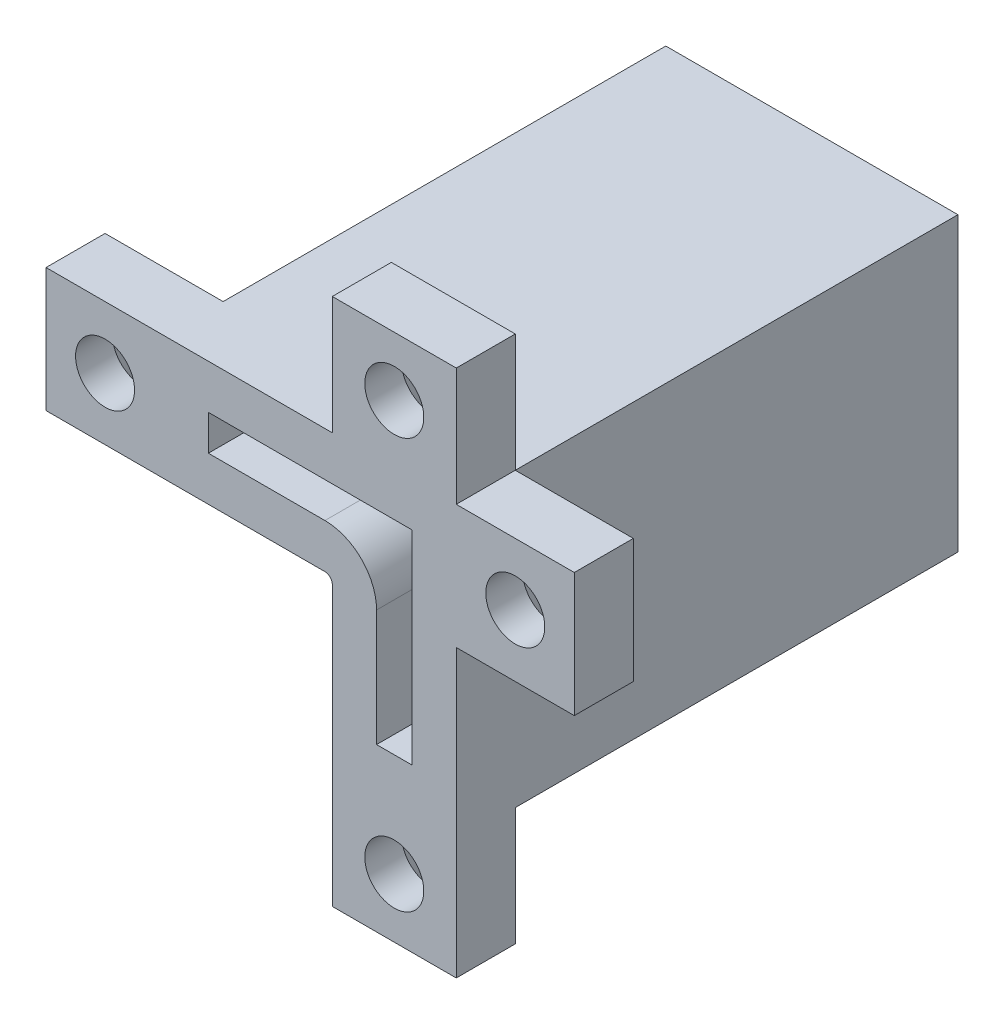
from build123d import *

# Parameters (mm, degrees)
BOSS_EXTRUDE1_DEPTH = 30
BOSS_EXTRUDE2_DEPTH = 4
SKETCH4_R           = 2
CUT_EXTRUDE1_DEPTH  = 4
CHAMFER1_SIZE       = 1.5


with BuildPart() as part:
    # Sketch2 → Boss-Extrude1 (new body)
    with BuildSketch(Plane.XY.offset(10)):
        with BuildLine():
            Line((-14.944066591, 82.328103542), (-14.944066591, 62.528103542))
            Line((-14.944066591, 62.528103542), (-23.344066591, 62.528103542))
            Line((-23.344066591, 62.528103542), (-23.344066591, 73.428103542))
            ThreePointArc((-23.344066591, 73.428103542), (-23.490513201, 73.781656932), (-23.844066591, 73.928103542))
            Line((-23.844066591, 73.928103542), (-34.744066591, 73.928103542))
            Line((-34.744066591, 73.928103542), (-34.744066591, 82.328103542))
            Line((-34.744066591, 82.328103542), (-14.944066591, 82.328103542))
        make_face()
        with BuildLine():
            Line((-17.944066591, 79.328103542), (-17.944066591, 65.528103542))
            Line((-17.944066591, 65.528103542), (-20.344066591, 65.528103542))
            Line((-20.344066591, 65.528103542), (-20.344066591, 73.428103542))
            ThreePointArc((-20.344066591, 73.428103542), (-21.369192857, 75.902977276), (-23.844066591, 76.928103542))
            Line((-23.844066591, 76.928103542), (-31.744066591, 76.928103542))
            Line((-31.744066591, 76.928103542), (-31.744066591, 79.328103542))
            Line((-31.744066591, 79.328103542), (-17.944066591, 79.328103542))
        make_face(mode=Mode.SUBTRACT)
    extrude(amount=BOSS_EXTRUDE1_DEPTH)

    # Sketch3 → Boss-Extrude2 (add)
    with BuildSketch(Plane.XY.offset(40)):
        with BuildLine():
            Line((-34.744066591, 82.328103542), (-42.744066591, 82.328103542))
            Line((-42.744066591, 82.328103542), (-42.744066591, 73.928103542))
            Line((-42.744066591, 73.928103542), (-34.744066591, 73.928103542))
            Line((-34.744066591, 73.928103542), (-23.844066591, 73.928103542))
            ThreePointArc((-23.844066591, 73.928103542), (-23.490513201, 73.781656932), (-23.344066591, 73.428103542))
            Line((-23.344066591, 73.428103542), (-23.344066591, 62.528103542))
            Line((-23.344066591, 62.528103542), (-23.344066591, 54.528103542))
            Line((-23.344066591, 54.528103542), (-14.944066591, 54.528103542))
            Line((-14.944066591, 54.528103542), (-14.944066591, 62.528103542))
            Line((-14.944066591, 62.528103542), (-14.944066591, 73.928103542))
            Line((-14.944066591, 73.928103542), (-6.944066591, 73.928103542))
            Line((-6.944066591, 73.928103542), (-6.944066591, 82.328103542))
            Line((-6.944066591, 82.328103542), (-14.944066591, 82.328103542))
            Line((-14.944066591, 82.328103542), (-14.944066591, 90.328103542))
            Line((-14.944066591, 90.328103542), (-23.344066591, 90.328103542))
            Line((-23.344066591, 90.328103542), (-23.344066591, 82.328103542))
            Line((-23.344066591, 82.328103542), (-34.744066591, 82.328103542))
        make_face()
        with BuildLine():
            Line((-31.744066591, 76.928103542), (-23.844066591, 76.928103542))
            ThreePointArc((-23.844066591, 76.928103542), (-21.369192857, 75.902977276), (-20.344066591, 73.428103542))
            Line((-20.344066591, 73.428103542), (-20.344066591, 65.528103542))
            Line((-20.344066591, 65.528103542), (-17.944066591, 65.528103542))
            Line((-17.944066591, 65.528103542), (-17.944066591, 79.328103542))
            Line((-17.944066591, 79.328103542), (-31.744066591, 79.328103542))
            Line((-31.744066591, 79.328103542), (-31.744066591, 76.928103542))
        make_face(mode=Mode.SUBTRACT)
    extrude(amount=BOSS_EXTRUDE2_DEPTH)

    # Sketch4 → Cut-Extrude1 (cut)
    with BuildSketch(Plane(origin=(0, 0, 40), x_dir=(-1, 0, 0), z_dir=(0, 0, -1))):
        with Locations((19.144066591, 86.328103542)):
            Circle(SKETCH4_R)
        with Locations((10.944066591, 78.128103542)):
            Circle(SKETCH4_R)
        with Locations((38.744066591, 78.128103542)):
            Circle(SKETCH4_R)
        with Locations((19.144066591, 58.528103542)):
            Circle(SKETCH4_R)
    extrude(amount=-CUT_EXTRUDE1_DEPTH, mode=Mode.SUBTRACT)

    # Chamfer1
    chamfer1_edges = [part.edges().sort_by_distance(p)[0] for p in [
        (-17.144066591, 86.328103542, 40),
        (-8.944066591, 78.128103542, 40),
        (-36.744066591, 78.128103542, 40),
        (-17.144066591, 58.528103542, 40),
    ]]
    chamfer(chamfer1_edges, length=CHAMFER1_SIZE)


solid = part.part
